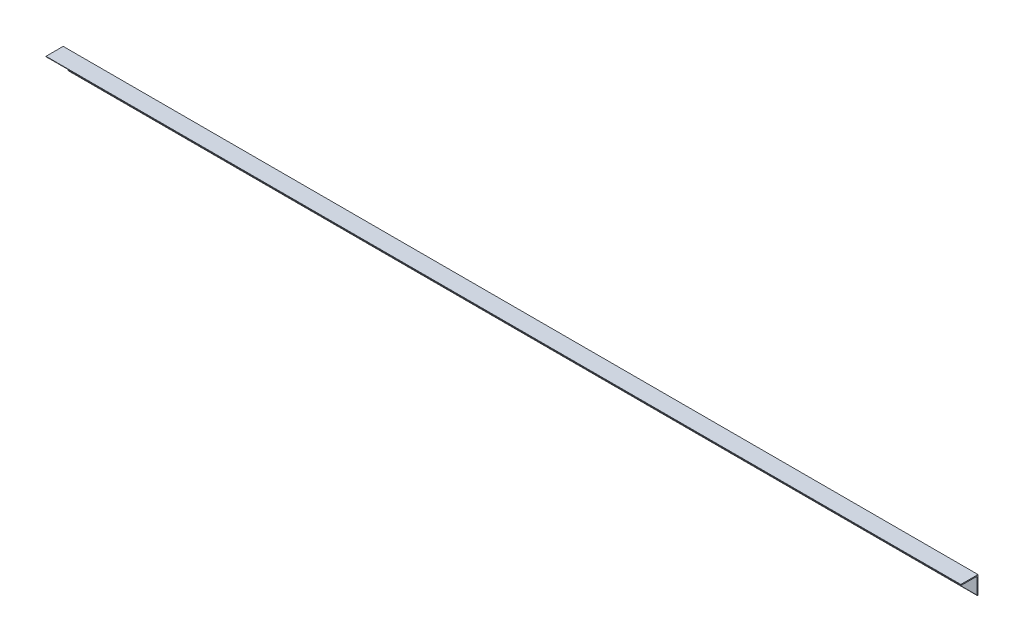
from build123d import *

# Parameters (mm, degrees)
ANGLE_IRON_35_X_35_X_5_2_DEPTH = 4525
CUT_EXTRUDE2_DEPTH             = 4527.60192639
CUT_EXTRUDE2_DEPTH_BACK        = 4527.60192639
SKETCH15_W                     = 30
SKETCH15_H                     = 85


with BuildPart() as part:
    # Sketch13 → Angle iron 35 X 35 X 5(2) (new body)
    with BuildSketch(Plane(origin=(0, 0, 0), x_dir=(0, -1, 0), z_dir=(-1, 0, 0))):
        with BuildLine():
            Line((0, 0), (0, 85))
            ThreePointArc((0, 85), (3.535533906, 83.535533906), (5, 80))
            Line((5, 80), (5, 10))
            ThreePointArc((5, 10), (6.464466094, 6.464466094), (10, 5))
            Line((10, 5), (85, 5))
            ThreePointArc((85, 5), (88.535533906, 3.535533906), (90, 0))
            Line((90, 0), (0, 0))
        make_face()
    extrude(amount=ANGLE_IRON_35_X_35_X_5_2_DEPTH)

    # Sketch15 → Cut-Extrude2 (cut, two sides: drawn at the far end of the back side and taken through both)
    with BuildSketch(Plane.XY.offset(5).offset(-CUT_EXTRUDE2_DEPTH_BACK)):
        with Locations((-4510, -47.5)):
            Rectangle(SKETCH15_W, SKETCH15_H)
    extrude(amount=CUT_EXTRUDE2_DEPTH + CUT_EXTRUDE2_DEPTH_BACK, mode=Mode.SUBTRACT)


solid = part.part
